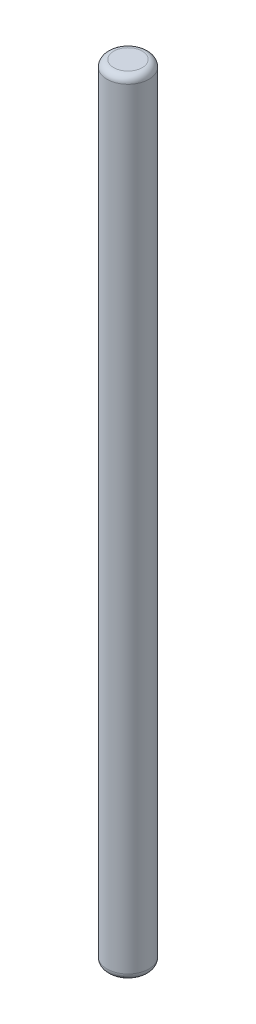
from build123d import *

# Parameters (mm, degrees)
SKETCH1_R           = 2.38125
BOSS_EXTRUDE1_DEPTH = 88.9
FILLET1_R           = 0.762


with BuildPart() as part:
    # Sketch1 → Boss-Extrude1 (new body)
    with BuildSketch(Plane(origin=(0, 0, 0), x_dir=(1, 0, 0), z_dir=(0, 1, 0))):
        with Locations(Location((0, 0, 0), (0, 0, 270))):
            Circle(SKETCH1_R)
    extrude(amount=BOSS_EXTRUDE1_DEPTH)

    # Fillet1
    fillet1_edges = [part.edges().sort_by_distance(p)[0] for p in [
        (0, 0, -2.38125),
        (0, 88.9, -2.38125),
    ]]
    fillet(fillet1_edges, radius=FILLET1_R)


solid = part.part
